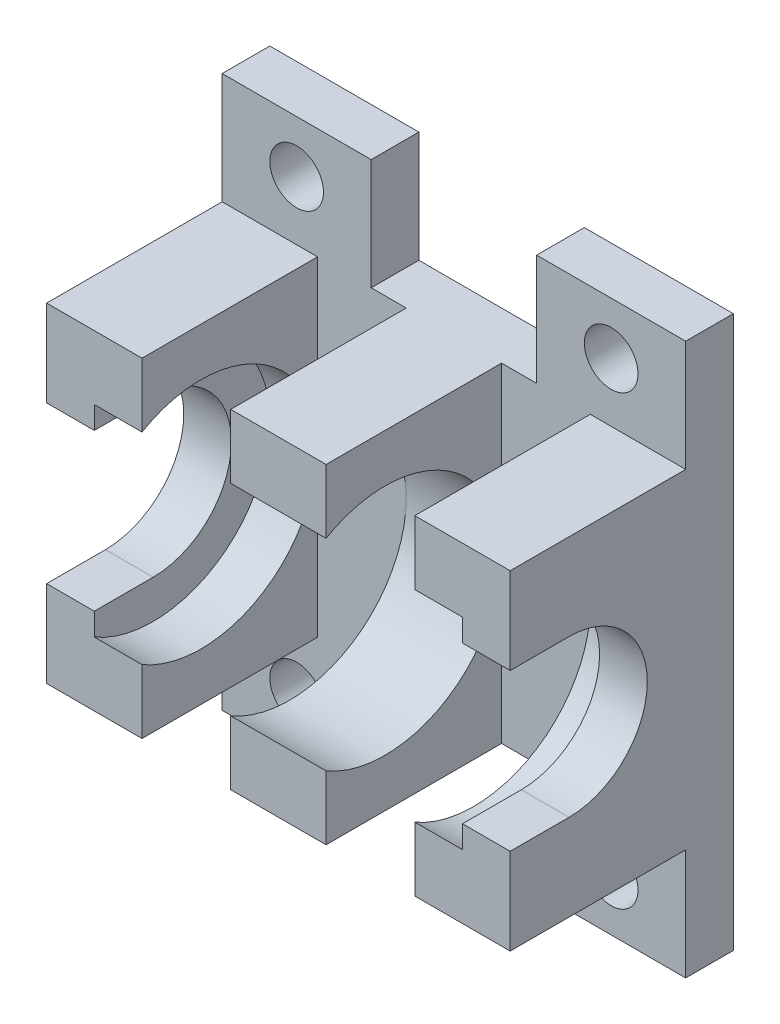
from build123d import *

# Parameters (mm, degrees)
SCHIZZO1_R         = 1.8
BASE_DEPTH         = 3.2
SCHIZZO2_W         = 6.4
SCHIZZO2_H         = 22.1
STAND_OFF_DEPTH    = 11.775
SCHIZZO3_R         = 7.826
BEARING_SLOT_DEPTH = 12.35
SHAFT_HOLES_REACH  = 41.163


with BuildPart() as part:
    # Schizzo1 → Base (new body)
    with BuildSketch(Plane.XY):
        Polygon((-15.55, 11.05), (-15.55, 18.5), (-5.55, 18.5), (-5.55, 11.05), (5.55, 11.05), (5.55, 18.5), (15.55, 18.5), (15.55, 11.05), (15.55, -11.05), (15.55, -18.5), (5.55, -18.5), (5.55, -11.05), (-5.55, -11.05), (-5.55, -18.5), (-15.55, -18.5), (-15.55, -11.05), align=None)
        with Locations((-10.55, 15)):
            Circle(SCHIZZO1_R, mode=Mode.SUBTRACT)
        with Locations(Location((10.55, 15, 0), (0, 0, 180))):
            Circle(SCHIZZO1_R, mode=Mode.SUBTRACT)
        with Locations((10.55, -15)):
            Circle(SCHIZZO1_R, mode=Mode.SUBTRACT)
        with Locations(Location((-10.55, -15, 0), (0, 0, 180))):
            Circle(SCHIZZO1_R, mode=Mode.SUBTRACT)
    extrude(amount=BASE_DEPTH)

    # Schizzo2 → Stand-off (add)
    with BuildSketch(Plane.XY.offset(3.2)):
        with Locations((-12.35, 0)):
            Rectangle(SCHIZZO2_W, SCHIZZO2_H)
        Rectangle(SCHIZZO2_W, SCHIZZO2_H)
        with Locations((12.35, 0)):
            Rectangle(SCHIZZO2_W, SCHIZZO2_H)
    extrude(amount=STAND_OFF_DEPTH)

    # Schizzo3 → Bearing slot (cut, symmetric)
    with BuildSketch(Plane(origin=(0, 0, 0), x_dir=(0, 0, -1), z_dir=(1, 0, 0))):
        with Locations((-11.026, 0)):
            Circle(SCHIZZO3_R)
    extrude(amount=BEARING_SLOT_DEPTH, both=True, mode=Mode.SUBTRACT)

    # Shaft holes: up to this face of the body (flat: up to its plane)
    shaft_holes_end = Plane(part.part.faces().sort_by_distance((15.55, 0, 6.746095849))[0])
    # Schizzo4 → Shaft holes (cut, up to the picked face)
    with BuildSketch(Plane.ZY.offset(15.55), mode=Mode.PRIVATE) as shaft_holes_sk1:
        with BuildLine():
            Line((11.026, 5.25), (14.975, 5.25))
            Line((14.975, 5.25), (14.975, -5.25))
            Line((14.975, -5.25), (11.026, -5.25))
            ThreePointArc((11.026, -5.25), (5.776, 0), (11.026, 5.25))
        make_face()
    shaft_holes_tool1 = split(extrude(shaft_holes_sk1.sketch, amount=-SHAFT_HOLES_REACH, mode=Mode.PRIVATE), bisect_by=shaft_holes_end, keep=Keep.BOTH, mode=Mode.PRIVATE)
    add(shaft_holes_tool1.solids().sort_by(Axis((-15.55, 0, 10.853782), (1, 0, 0)))[0], mode=Mode.SUBTRACT)


solid = part.part
